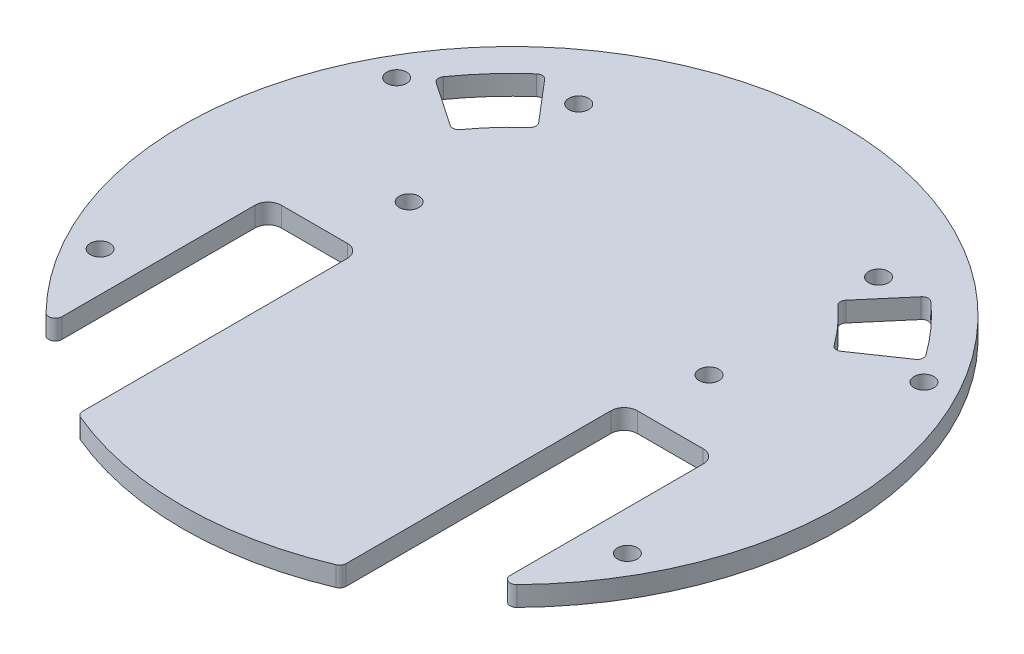
from build123d import *

# Parameters (mm, degrees)
SKETCH1_R           = 50
BOSS_EXTRUDE1_DEPTH = 3
SKETCH2_R           = 1.5
CUT_EXTRUDE1_DEPTH  = 10
SKETCH3_W           = 14
SKETCH3_H           = 45
CUT_EXTRUDE2_DEPTH  = 10
FILLET1_R           = 1
SKETCH4_R           = 1.5
CUT_EXTRUDE3_DEPTH  = 10
FILLET2_R           = 2
CUT_EXTRUDE5_DEPTH  = 3


with BuildPart() as part:
    # Sketch1 → Boss-Extrude1 (new body)
    with BuildSketch(Plane(origin=(0, 0, 0), x_dir=(1, 0, 0), z_dir=(0, 1, 0))):
        with Locations(Location((0, 0, 0), (0, 0, 270))):
            Circle(SKETCH1_R)
    extrude(amount=BOSS_EXTRUDE1_DEPTH)

    # Sketch2 → Cut-Extrude1 (cut)
    with BuildSketch(Plane(origin=(0, 3, 0), x_dir=(1, 0, 0), z_dir=(0, 1, 0))):
        with Locations(Location((-22.75, 32.86, 0), (0, 0, 270))):
            Circle(SKETCH2_R)
        with Locations(Location((22.75, 32.86, 0), (0, 0, 270))):
            Circle(SKETCH2_R)
        with Locations(Location((22.75, 7.14, 0), (0, 0, 270))):
            Circle(SKETCH2_R)
        with Locations(Location((-22.75, 7.14, 0), (0, 0, 270))):
            Circle(SKETCH2_R)
    extrude(amount=-CUT_EXTRUDE1_DEPTH, mode=Mode.SUBTRACT)

    # Sketch3 → Cut-Extrude2 (cut)
    with BuildSketch(Plane.XZ):
        with Locations((-27, 25.5)):
            Rectangle(SKETCH3_W, SKETCH3_H)
        with Locations((27, 25.5)):
            Rectangle(SKETCH3_W, SKETCH3_H)
    extrude(amount=-CUT_EXTRUDE2_DEPTH, mode=Mode.SUBTRACT)

    # Fillet1
    fillet1_edges = [part.edges().sort_by_distance(p)[0] for p in [
        (-34, 1.5, 36.66060556),
        (-20, 1.5, 45.82575695),
        (34, 1.5, 36.66060556),
        (20, 1.5, 45.82575695),
    ]]
    fillet(fillet1_edges, radius=FILLET1_R)

    # Sketch4 → Cut-Extrude3 (cut)
    with BuildSketch(Plane.XZ):
        with Locations(Location((-40, 22.5, 0), (0, 0, 270))):
            Circle(SKETCH4_R)
        with Locations(Location((-40, -22.5, 0), (0, 0, 270))):
            Circle(SKETCH4_R)
        with Locations(Location((40, -22.5, 0), (0, 0, 270))):
            Circle(SKETCH4_R)
        with Locations(Location((40, 22.5, 0), (0, 0, 270))):
            Circle(SKETCH4_R)
    extrude(amount=-CUT_EXTRUDE3_DEPTH, mode=Mode.SUBTRACT)

    # Fillet2
    fillet2_edges = [part.edges().sort_by_distance(p)[0] for p in [
        (-34, 1.5, 3),
        (-20, 1.5, 3),
        (20, 1.5, 3),
        (34, 1.5, 3),
    ]]
    fillet(fillet2_edges, radius=FILLET2_R)

    # Sketch6 → Cut-Extrude5 (cut)
    with BuildSketch(Plane(origin=(0, 3, 0), x_dir=(1, 0, 0), z_dir=(0, 1, 0))):
        with BuildLine():
            Line((23.309994817, 27.350423227), (28.567392471, 33.519109752))
            ThreePointArc((28.567392471, 33.519109752), (29.22412311, 33.850150921), (29.920063035, 33.612346362))
            ThreePointArc((29.920063035, 33.612346362), (33.463097983, 30.086892052), (36.593306958, 26.190263189))
            ThreePointArc((36.593306958, 26.190263189), (36.756034947, 25.473044262), (36.357273652, 24.855085673))
            Line((36.357273652, 24.855085673), (29.666265874, 20.280882086))
            ThreePointArc((29.666265874, 20.280882086), (28.968053798, 20.129465624), (28.362226288, 20.508147649))
            ThreePointArc((28.362226288, 20.508147649), (26.026853987, 23.400916041), (23.397812241, 26.029644299))
            ThreePointArc((23.397812241, 26.029644299), (23.085451973, 26.672184656), (23.309994817, 27.350423227))
        make_face()
        with BuildLine():
            Line((-23.309994817, 27.350423227), (-28.567392471, 33.519109752))
            ThreePointArc((-28.567392471, 33.519109752), (-29.22412311, 33.850150921), (-29.920063035, 33.612346362))
            ThreePointArc((-29.920063035, 33.612346362), (-33.463097983, 30.086892052), (-36.593306958, 26.190263189))
            ThreePointArc((-36.593306958, 26.190263189), (-36.756034947, 25.473044262), (-36.357273652, 24.855085673))
            Line((-36.357273652, 24.855085673), (-29.666265874, 20.280882086))
            ThreePointArc((-29.666265874, 20.280882086), (-28.968053798, 20.129465624), (-28.362226288, 20.508147649))
            ThreePointArc((-28.362226288, 20.508147649), (-26.026853987, 23.400916041), (-23.397812241, 26.029644299))
            ThreePointArc((-23.397812241, 26.029644299), (-23.085451973, 26.672184656), (-23.309994817, 27.350423227))
        make_face()
    extrude(amount=-CUT_EXTRUDE5_DEPTH, mode=Mode.SUBTRACT)


solid = part.part
